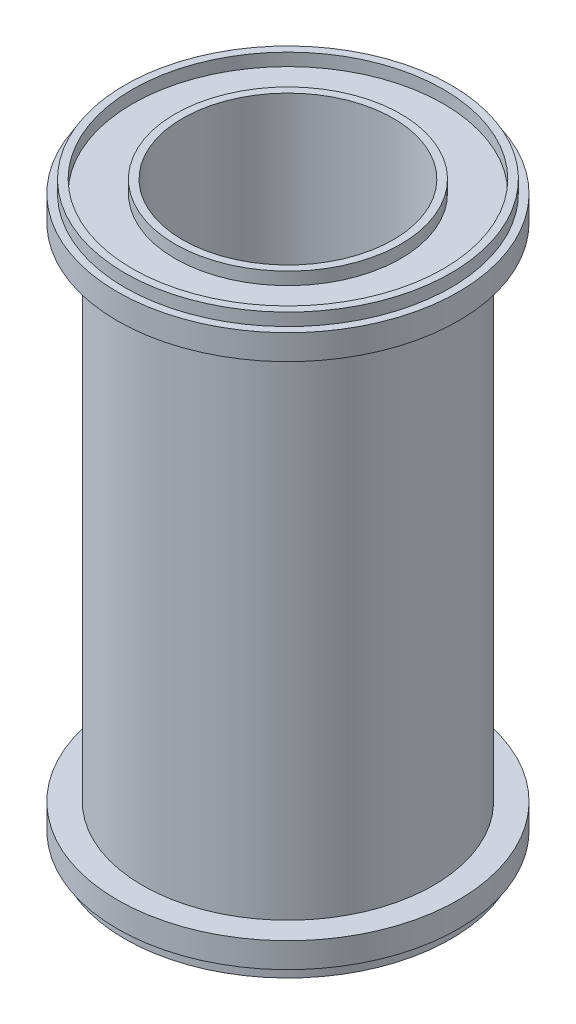
from build123d import *


with BuildPart() as part:
    # Sketch1 → Revolve1 (revolve)
    with BuildSketch(Plane.YZ):
        Polygon((11.5, 4.5), (11.5, 4.2), (-11.5, 4.2), (-11.5, 4.5), (-11, 4.5), (-11, 6.2), (-11.5, 6.2), (-11.5, 6.5), (-11, 6.5), (-11, 6.8), (-10, 6.8), (-10, 5.8), (10, 5.8), (10, 6.8), (11, 6.8), (11, 6.5), (11.5, 6.5), (11.5, 6.2), (11, 6.2), (11, 4.5), align=None)
    revolve(axis=Axis((0, 0, 0), (0, 1, 0)))


solid = part.part
